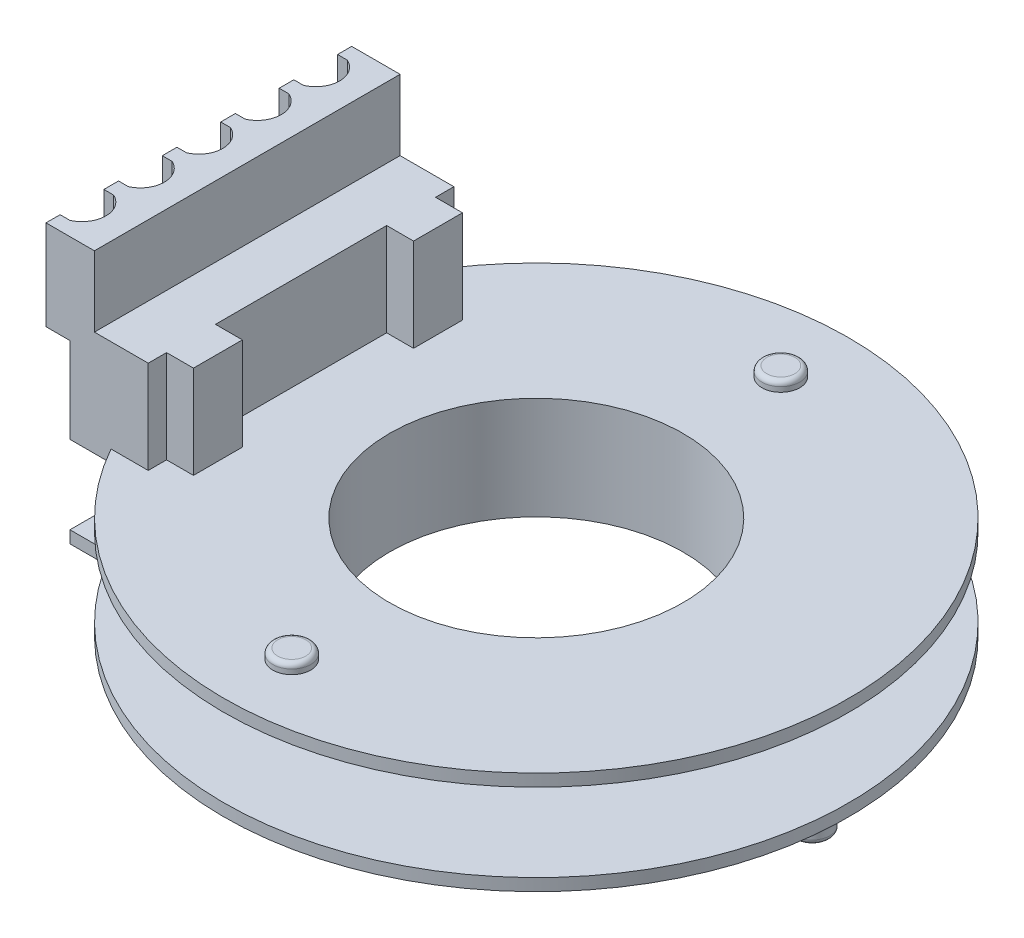
from build123d import *

# Parameters (mm, degrees)
EXTRUDE_1_DEPTH      = 3.8
EXTRUDE_1_DEPTH_BACK = 0.5
SKETCH_2_W           = 3.35
SKETCH_2_H           = 12.5
SKETCH_4_W           = 0.95
SKETCH_4_H           = 12.5
EXTRUDE_2_DEPTH      = 3.8
SKETCH_6_W           = 1.1
SKETCH_6_H           = 0.75
SKETCH_6_H_2         = 7
CUT_EXTRUDE_1_DEPTH  = 3.8
EXTRUDE_3_DEPTH      = 2.88
EXTRUDE_3_DEPTH_BACK = 0.8
SKETCH_7_W           = 1.98
SKETCH_7_H           = 12.5
SKETCH_8_R           = 0.425
EXTRUDE_4_DEPTH      = 2.4
EXTRUDE_4_2_DEPTH    = 2.4
EXTRUDE_4_3_DEPTH    = 2.4
CUT_EXTRUDE_2_DEPTH  = 3.68
SKETCH_10_R          = 0.775
EXTRUDE_5_DEPTH      = 0.4
EXTRUDE_START        = 0.4
SKETCH_11_R          = 0.775
SKETCH_11_R_2        = 0.725
EXTRUDE_6_DEPTH      = 0.4
EXTRUDE_START_2      = 0.85
SKETCH_12_R          = 0.725
EXTRUDE_7_DEPTH      = 0.85
FILLET_1_R           = 0.2
SKETCH_13_W          = 2.325
SKETCH_13_H          = 12.5
EXTRUDE_8_DEPTH      = 0.5


with BuildPart() as part:
    # Эскиз1 → Повернуть1 (revolve)
    with BuildSketch(Plane.XY, mode=Mode.PRIVATE) as revolve_1_sk:
        Polygon((7, 1.6), (7, -1.6), (12.775, -1.6), (12.775, -2.1), (6, -2.1), (6, 2.1), (12.775, 2.1), (12.775, 1.6), align=None)
    revolve(revolve_1_sk.sketch.rotate(Axis((0, 2.1, 0), (0, -1, 0)), 180), axis=Axis((0, 2.1, 0), (0, -1, 0)))

    # Эскиз2 → Бобышка-Вытянуть1 (add, two sides: drawn at the far end of the back side and taken through both)
    with BuildSketch(Plane(origin=(0, 2.1, 0), x_dir=(1, 0, 0), z_dir=(0, 1, 0)).offset(-EXTRUDE_1_DEPTH_BACK)):
        with Locations((-11.145, 0)):
            Rectangle(SKETCH_2_W, SKETCH_2_H)
    extrude(amount=EXTRUDE_1_DEPTH + EXTRUDE_1_DEPTH_BACK)

    # Эскиз4 → Бобышка-Вытянуть2 (add)
    with BuildSketch(Plane(origin=(0, 5.9, 0), x_dir=(1, 0, 0), z_dir=(0, 1, 0))):
        with Locations((-8.995, 0)):
            Rectangle(SKETCH_4_W, SKETCH_4_H)
    extrude(amount=-EXTRUDE_2_DEPTH)

    # Эскиз6 → Вырез-Вытянуть1 (cut)
    with BuildSketch(Plane(origin=(0, 5.9, 0), x_dir=(1, 0, 0), z_dir=(0, 1, 0))):
        with Locations((-9.07, 5.875)):
            Rectangle(SKETCH_6_W, SKETCH_6_H)
        with Locations((-9.07, 0)):
            Rectangle(SKETCH_6_W, SKETCH_6_H_2)
        with Locations((-9.07, -5.875)):
            Rectangle(SKETCH_6_W, SKETCH_6_H)
    extrude(amount=-CUT_EXTRUDE_1_DEPTH, mode=Mode.SUBTRACT)

    # Эскиз7 → Бобышка-Вытянуть3 (add, two sides: drawn at the far end of the back side and taken through both)
    with BuildSketch(Plane(origin=(0, 5.9, 0), x_dir=(1, 0, 0), z_dir=(0, 1, 0)).offset(-EXTRUDE_3_DEPTH_BACK)):
        with Locations((-12.81, 0)):
            Rectangle(SKETCH_7_W, SKETCH_7_H)
    extrude(amount=EXTRUDE_3_DEPTH + EXTRUDE_3_DEPTH_BACK)

    # Эскиз9 → Вырез-Вытянуть2 (cut)
    with BuildSketch(Plane(origin=(0, 8.78, 0), x_dir=(1, 0, 0), z_dir=(0, 1, 0))):
        with BuildLine():
            Line((-13.4, 3.28395231), (-13.8, 3.28395231))
            Line((-13.8, 3.28395231), (-13.8, 1.49465077))
            Line((-13.8, 1.49465077), (-13.4, 1.49465077))
            ThreePointArc((-13.4, 1.49465077), (-12.82, 2.38930154), (-13.4, 3.28395231))
        make_face()
        with BuildLine():
            Line((-13.4, -1.49465077), (-13.8, -1.49465077))
            Line((-13.8, -1.49465077), (-13.8, -3.28395231))
            Line((-13.8, -3.28395231), (-13.4, -3.28395231))
            ThreePointArc((-13.4, -3.28395231), (-12.82, -2.38930154), (-13.4, -1.49465077))
        make_face()
        with BuildLine():
            Line((-13.4, 0.89465077), (-13.8, 0.89465077))
            Line((-13.8, 0.89465077), (-13.8, -0.89465077))
            Line((-13.8, -0.89465077), (-13.4, -0.89465077))
            ThreePointArc((-13.4, -0.89465077), (-12.82, 0), (-13.4, 0.89465077))
        make_face()
        with BuildLine():
            Line((-13.4, 5.673253849), (-13.8, 5.673253849))
            Line((-13.8, 5.673253849), (-13.8, 3.88395231))
            Line((-13.8, 3.88395231), (-13.4, 3.88395231))
            ThreePointArc((-13.4, 3.88395231), (-12.82, 4.778603079), (-13.4, 5.673253849))
        make_face()
        with BuildLine():
            Line((-13.4, -3.88395231), (-13.8, -3.88395231))
            Line((-13.8, -3.88395231), (-13.8, -5.673253849))
            Line((-13.8, -5.673253849), (-13.4, -5.673253849))
            ThreePointArc((-13.4, -5.673253849), (-12.82, -4.778603079), (-13.4, -3.88395231))
        make_face()
    extrude(amount=-CUT_EXTRUDE_2_DEPTH, mode=Mode.SUBTRACT)

    # Эскиз10 → Бобышка-Вытянуть5 (add)
    with BuildSketch(Plane(origin=(0, 2.1, 0), x_dir=(1, 0, 0), z_dir=(0, 1, 0))):
        with Locations((0, 10)):
            Circle(SKETCH_10_R)
        with Locations((0, -10)):
            Circle(SKETCH_10_R)
    extrude(amount=EXTRUDE_5_DEPTH)

    # Эскиз11 → Бобышка-Вытянуть6 (add)
    with BuildSketch(Plane.XZ.offset(2.1).offset(EXTRUDE_START)):
        with Locations((0, -10)):
            Circle(SKETCH_11_R)
        with Locations((0, 10)):
            Circle(SKETCH_11_R)
        with Locations(Location((11.28, 0, 0), (0, 0, 180))):
            Circle(SKETCH_11_R_2)
        with Locations(Location((-11.22, 5.35, 0), (0, 0, 217.573114976))):
            Circle(SKETCH_11_R_2)
        with Locations(Location((-11.22, -5.35, 0), (0, 0, 142.426885024))):
            Circle(SKETCH_11_R_2)
    extrude(amount=-EXTRUDE_6_DEPTH)

    # Эскиз12 → Бобышка-Вытянуть7 (add)
    with BuildSketch(Plane.XZ.offset(2.5).offset(EXTRUDE_START_2)):
        with Locations(Location((11.28, 0, 0), (0, 0, 180))):
            Circle(SKETCH_12_R)
        with Locations(Location((-11.22, -5.35, 0), (0, 0, 142.426885024))):
            Circle(SKETCH_12_R)
        with Locations(Location((-11.22, 5.35, 0), (0, 0, 217.573114976))):
            Circle(SKETCH_12_R)
    extrude(amount=-EXTRUDE_7_DEPTH)

    # Скругление1
    fillet_1_edges = [part.edges().sort_by_distance(p)[0] for p in [
        (-0.775, 2.5, -10),
        (-0.775, 2.5, 10),
        (-0.775, -2.5, -10),
        (-0.775, -2.5, 10),
        (12.005, -3.35, 0),
        (-10.645382504, -3.35, -5.792085663),
        (-10.645382504, -3.35, 5.792085663),
    ]]
    fillet(fillet_1_edges, radius=FILLET_1_R)

    # Эскиз13 → Бобышка-Вытянуть8 (add)
    with BuildSketch(Plane.XZ.offset(2.1)):
        with Locations((-11.6575, 0)):
            Rectangle(SKETCH_13_W, SKETCH_13_H)
    extrude(amount=-EXTRUDE_8_DEPTH)


with BuildPart() as body_2:
    # Эскиз8 → Бобышка-Вытянуть4 (new body)
    with BuildSketch(Plane.ZY.offset(12.82)):
        with Locations(Location((-2.4, 2.45, 0), (0, 0, 270))):
            Circle(SKETCH_8_R)
    extrude(amount=EXTRUDE_4_DEPTH)


with BuildPart() as body_3:
    # Эскиз8 → Extrude 4 2 (new body)
    with BuildSketch(Plane.ZY.offset(12.82)):
        with Locations(Location((0, 2.45, 0), (0, 0, 270))):
            Circle(SKETCH_8_R)
    extrude(amount=EXTRUDE_4_2_DEPTH)


with BuildPart() as body_4:
    # Эскиз8 → Extrude 4 3 (new body)
    with BuildSketch(Plane.ZY.offset(12.82)):
        with Locations(Location((2.4, 2.45, 0), (0, 0, 270))):
            Circle(SKETCH_8_R)
    extrude(amount=EXTRUDE_4_3_DEPTH)


solid = Compound([part.part, body_2.part, body_3.part, body_4.part])
